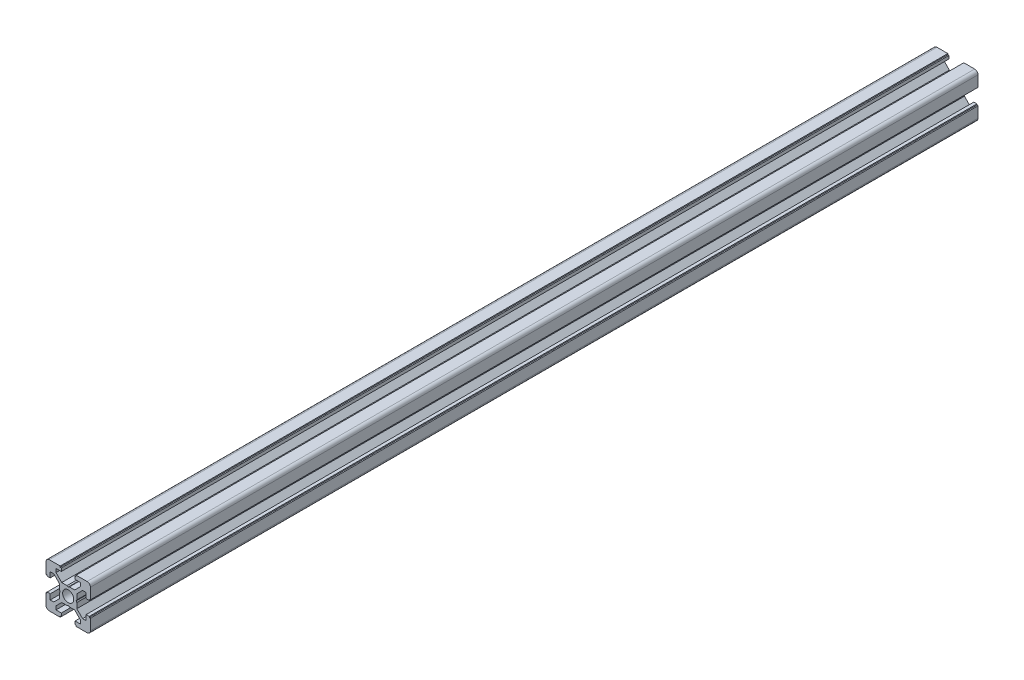
from build123d import *

# Parameters (mm, degrees)
SKETCH_28_R     = 2.5
EXTRUDE_1_DEPTH = 400


with BuildPart() as part:
    # 草图28 → 凸台-拉伸1 (new body)
    with BuildSketch(Plane.XY):
        with BuildLine():
            Line((-3.9, -0.519615242), (-3.9, -2.910050506))
            Line((-3.9, -2.910050506), (-6.489949494, -5.5))
            Line((-6.489949494, -5.5), (-8.1, -5.5))
            Line((-8.1, -5.5), (-8.1, -3.1))
            Line((-8.1, -3.1), (-9.5, -3.1))
            Line((-9.5, -3.1), (-9.5, -3.6))
            Line((-9.5, -3.6), (-10, -3.6))
            Line((-10, -3.6), (-10, -8.5))
            ThreePointArc((-10, -8.5), (-9.560660172, -9.560660172), (-8.5, -10))
            Line((-8.5, -10), (-3.6, -10))
            Line((-3.6, -10), (-3.6, -9.5))
            Line((-3.6, -9.5), (-3.1, -9.5))
            Line((-3.1, -9.5), (-3.1, -8.1))
            Line((-3.1, -8.1), (-5.5, -8.1))
            Line((-5.5, -8.1), (-5.5, -6.489949494))
            Line((-5.5, -6.489949494), (-2.910050506, -3.9))
            Line((-2.910050506, -3.9), (-0.519615242, -3.9))
            Line((-0.519615242, -3.9), (0, -3.6))
            Line((0, -3.6), (0.519615242, -3.9))
            Line((0.519615242, -3.9), (2.910050506, -3.9))
            Line((2.910050506, -3.9), (5.5, -6.489949494))
            Line((5.5, -6.489949494), (5.5, -8.1))
            Line((5.5, -8.1), (3.1, -8.1))
            Line((3.1, -8.1), (3.1, -9.5))
            Line((3.1, -9.5), (3.6, -9.5))
            Line((3.6, -9.5), (3.6, -10))
            Line((3.6, -10), (8.5, -10))
            ThreePointArc((8.5, -10), (9.560660172, -9.560660172), (10, -8.5))
            Line((10, -8.5), (10, -3.6))
            Line((10, -3.6), (9.5, -3.6))
            Line((9.5, -3.6), (9.5, -3.1))
            Line((9.5, -3.1), (8.1, -3.1))
            Line((8.1, -3.1), (8.1, -5.5))
            Line((8.1, -5.5), (6.489949494, -5.5))
            Line((6.489949494, -5.5), (3.9, -2.910050506))
            Line((3.9, -2.910050506), (3.9, -0.519615242))
            Line((3.9, -0.519615242), (3.6, 0))
            Line((3.6, 0), (3.9, 0.519615242))
            Line((3.9, 0.519615242), (3.9, 2.910050506))
            Line((3.9, 2.910050506), (6.489949494, 5.5))
            Line((6.489949494, 5.5), (8.1, 5.5))
            Line((8.1, 5.5), (8.1, 3.1))
            Line((8.1, 3.1), (9.5, 3.1))
            Line((9.5, 3.1), (9.5, 3.6))
            Line((9.5, 3.6), (10, 3.6))
            Line((10, 3.6), (10, 8.5))
            ThreePointArc((10, 8.5), (9.560660172, 9.560660172), (8.5, 10))
            Line((8.5, 10), (3.6, 10))
            Line((3.6, 10), (3.6, 9.5))
            Line((3.6, 9.5), (3.1, 9.5))
            Line((3.1, 9.5), (3.1, 8.1))
            Line((3.1, 8.1), (5.5, 8.1))
            Line((5.5, 8.1), (5.5, 6.489949494))
            Line((5.5, 6.489949494), (2.910050506, 3.9))
            Line((2.910050506, 3.9), (0.519615242, 3.9))
            Line((0.519615242, 3.9), (0, 3.6))
            Line((0, 3.6), (-0.519615242, 3.9))
            Line((-0.519615242, 3.9), (-2.910050506, 3.9))
            Line((-2.910050506, 3.9), (-5.5, 6.489949494))
            Line((-5.5, 6.489949494), (-5.5, 8.1))
            Line((-5.5, 8.1), (-3.1, 8.1))
            Line((-3.1, 8.1), (-3.1, 9.5))
            Line((-3.1, 9.5), (-3.6, 9.5))
            Line((-3.6, 9.5), (-3.6, 10))
            Line((-3.6, 10), (-8.5, 10))
            ThreePointArc((-8.5, 10), (-9.560660172, 9.560660172), (-10, 8.5))
            Line((-10, 8.5), (-10, 3.6))
            Line((-10, 3.6), (-9.5, 3.6))
            Line((-9.5, 3.6), (-9.5, 3.1))
            Line((-9.5, 3.1), (-8.1, 3.1))
            Line((-8.1, 3.1), (-8.1, 5.5))
            Line((-8.1, 5.5), (-6.489949494, 5.5))
            Line((-6.489949494, 5.5), (-3.9, 2.910050506))
            Line((-3.9, 2.910050506), (-3.9, 0.519615242))
            Line((-3.9, 0.519615242), (-3.6, 0))
            Line((-3.6, 0), (-3.9, -0.519615242))
        make_face()
        Circle(SKETCH_28_R, mode=Mode.SUBTRACT)
    extrude(amount=EXTRUDE_1_DEPTH)


solid = part.part
